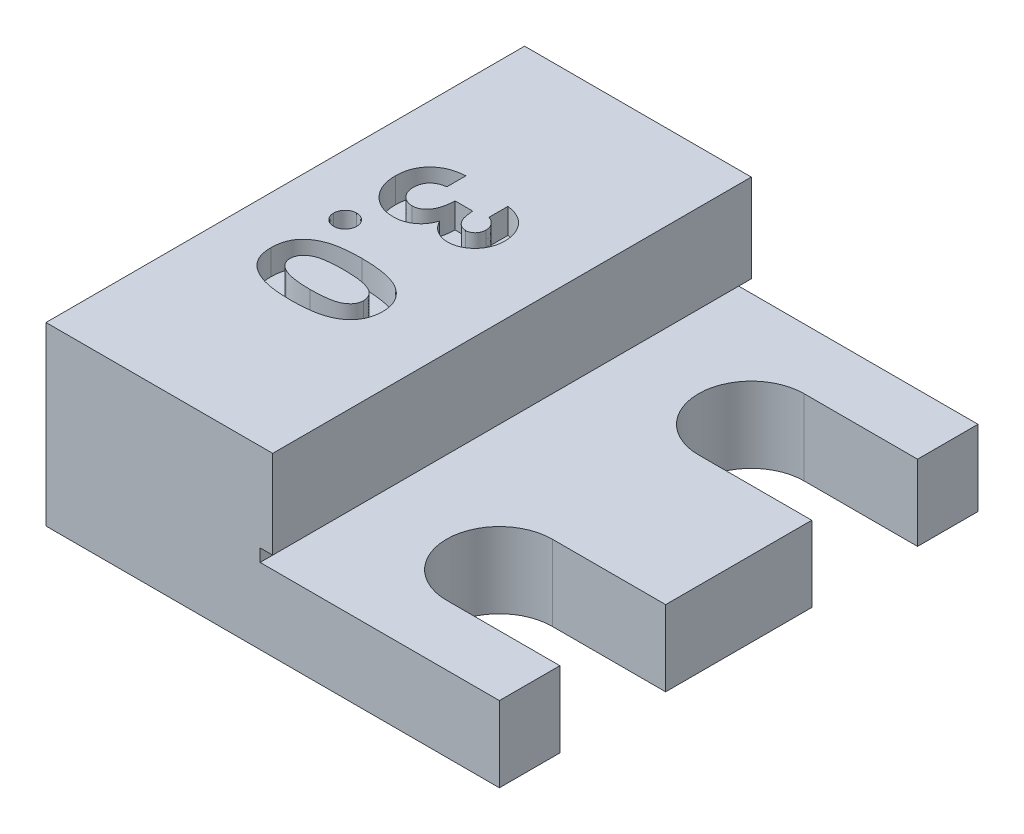
from build123d import *

# Parameters (mm, degrees)
BOSS_EXTRUDE1_DEPTH = 19
CUT_EXTRUDE1_DEPTH  = 28.092434368
CUT_EXTRUDE2_DEPTH  = 1
SKETCH4_W           = 6
SKETCH4_H           = 16
CUT_EXTRUDE3_DEPTH  = 5


with BuildPart() as part:
    # Sketch1 → Boss-Extrude1 (new body)
    with BuildSketch(Plane.XY):
        Polygon((0, 0), (18, 0), (18, 3), (9, 3), (8.5, 3), (8.5, 3.5), (9, 3.5), (9, 7), (0, 7), align=None)
    extrude(amount=BOSS_EXTRUDE1_DEPTH)

    # Sketch2 → Cut-Extrude1 (cut, through all)
    with BuildSketch(Plane(origin=(0, 7, 0), x_dir=(1, 0, 0), z_dir=(0, 1, 0))):
        with BuildLine():
            Line((13.5, -2.4), (18, -2.4))
            Line((18, -2.4), (18, -6.6))
            Line((18, -6.6), (13.5, -6.6))
            ThreePointArc((13.5, -6.6), (11.4, -4.5), (13.5, -2.4))
        make_face()
        with BuildLine():
            Line((13.5, -12.4), (18, -12.4))
            Line((18, -12.4), (18, -16.6))
            Line((18, -16.6), (13.5, -16.6))
            ThreePointArc((13.5, -16.6), (11.4, -14.5), (13.5, -12.4))
        make_face()
    extrude(amount=-CUT_EXTRUDE1_DEPTH, mode=Mode.SUBTRACT)

    # Sketch3 → Cut-Extrude2 (cut)
    # profile 1 of 3: a face of its own
    with BuildSketch(Plane(origin=(0, 7, 0), x_dir=(1, 0, 0), z_dir=(0, 1, 0))):
        with BuildLine():
            Line((5.176923077, -6.592307692), (5.176923077, -5.838461538))
            add(Edge.make_bspline(
                [(5.176923077, -5.838461538), (5.214605157, -5.843783979), (5.288478378, -5.854218271), (5.3954284, -5.879186137), (5.496877816, -5.909050398), (5.592505355, -5.946334403), (5.682481362, -5.990062475), (5.76711459, -6.039789948), (5.846041779, -6.096054396), (5.893587831, -6.139181691), (5.917307692, -6.160697115)],
                knots=[0, 0, 0, 0, 1.111473889, 2.178970933, 3.205615836, 4.199322666, 5.174200091, 6.12565194, 7.064921805, 8, 8, 8, 8], degree=3))
            add(Edge.make_bspline(
                [(5.917307692, -6.160697115), (5.948604331, -6.191730264), (6.010286716, -6.252893337), (6.089295038, -6.355104007), (6.157671368, -6.462239665), (6.211880616, -6.576448964), (6.255756723, -6.69595472), (6.285228403, -6.821707285), (6.304783123, -6.95319279), (6.306709331, -7.042915105), (6.307692308, -7.088701923)],
                knots=[0, 0, 0, 0, 1.01925491, 2.00884431, 2.983262333, 3.955970413, 4.92937149, 5.924503185, 6.940838805, 8, 8, 8, 8], degree=3))
            add(Edge.make_bspline(
                [(6.307692308, -7.088701923), (6.306731299, -7.12940876), (6.30484215, -7.209430199), (6.289677084, -7.32704158), (6.263079247, -7.439174188), (6.228303172, -7.5470133), (6.18098451, -7.648972952), (6.126057614, -7.747303493), (6.058687495, -7.839257565), (5.98256604, -7.925050322), (5.900233234, -8.003867332), (5.812226236, -8.072123208), (5.720895915, -8.13080401), (5.625483489, -8.179149229), (5.525827508, -8.216320132), (5.422503672, -8.242117842), (5.315739973, -8.259003069), (5.243174125, -8.260685279), (5.206370192, -8.261538462)],
                knots=[0, 0, 0, 0, 1.091422571, 2.145516843, 3.172569842, 4.178562979, 5.178154469, 6.181868002, 7.194278174, 8.227918432, 9.254613415, 10.245994977, 11.209837596, 12.161663635, 13.10878368, 14.055455738, 15.013766427, 16, 16, 16, 16], degree=3))
            add(Edge.make_bspline(
                [(5.206370192, -8.261538462), (5.160791586, -8.259787679), (5.071061325, -8.256340927), (4.93973442, -8.228057833), (4.814162463, -8.183787099), (4.696102394, -8.119833718), (4.585875506, -8.039875704), (4.487167015, -7.941769897), (4.398429306, -7.828310608), (4.350741651, -7.743135208), (4.326322115, -7.699519231)],
                knots=[0, 0, 0, 0, 0.992805628, 1.954529043, 2.915727527, 3.886831945, 4.871318353, 5.87440735, 6.911542536, 8, 8, 8, 8], degree=3))
            add(Edge.make_bspline(
                [(4.326322115, -7.699519231), (4.316493057, -7.729456568), (4.297179399, -7.788282094), (4.259141367, -7.871895505), (4.217572103, -7.951402305), (4.169279576, -8.025433414), (4.116216522, -8.094725163), (4.057929339, -8.15885514), (3.99454512, -8.218206507), (3.925715276, -8.271810377), (3.852540607, -8.319385905), (3.776711403, -8.362072894), (3.697077701, -8.397206665), (3.614548972, -8.426969343), (3.528383492, -8.449628952), (3.438915143, -8.465583342), (3.34634801, -8.47480537), (3.283633833, -8.476211887), (3.251923077, -8.476923077)],
                knots=[0, 0, 0, 0, 1.059543567, 2.081955587, 3.086750234, 4.076226789, 5.052108497, 6.020845489, 6.989030705, 7.970690546, 8.952259656, 9.923888338, 10.895517021, 11.877585046, 12.873342345, 13.889638361, 14.932918083, 16, 16, 16, 16], degree=3))
            add(Edge.make_bspline(
                [(3.251923077, -8.476923077), (3.205300655, -8.475604881), (3.11333167, -8.473004562), (2.978311637, -8.453156068), (2.848890045, -8.421274809), (2.724899153, -8.376486925), (2.606728476, -8.31782932), (2.49351837, -8.247043218), (2.386246112, -8.162857835), (2.285094999, -8.067712913), (2.192719092, -7.962389478), (2.112711154, -7.848076645), (2.044029642, -7.727435892), (1.988277264, -7.599664549), (1.945340199, -7.464817524), (1.914303665, -7.323192531), (1.895314912, -7.174195286), (1.893324308, -7.072492978), (1.892307692, -7.020552885)],
                knots=[0, 0, 0, 0, 1.00521177, 1.982915163, 2.936446867, 3.875909237, 4.819955514, 5.776532521, 6.750505675, 7.756026749, 8.767695971, 9.766152086, 10.760201606, 11.756952477, 12.766920653, 13.807416198, 14.880231815, 16, 16, 16, 16], degree=3))
            add(Edge.make_bspline(
                [(1.892307692, -7.020552885), (1.893379267, -6.971418235), (1.895474591, -6.87534193), (1.913619223, -6.734812939), (1.942867752, -6.601243152), (1.984166126, -6.474339599), (2.037374572, -6.354642564), (2.101598051, -6.241454692), (2.178804377, -6.136011646), (2.267171969, -6.03782798), (2.364949621, -5.947736072), (2.472934326, -5.869217452), (2.588766526, -5.800885556), (2.71269532, -5.742289404), (2.845826489, -5.696506963), (2.986971118, -5.660097402), (3.136739527, -5.634749059), (3.239774518, -5.627018439), (3.292307692, -5.623076923)],
                knots=[0, 0, 0, 0, 1.066693477, 2.085777942, 3.071407889, 4.032495163, 4.978645371, 5.911608997, 6.853298848, 7.810770565, 8.776420673, 9.735131334, 10.704462168, 11.693492242, 12.70668109, 13.756973703, 14.856375978, 16, 16, 16, 16], degree=3))
            Line((3.292307692, -5.623076923), (3.292307692, -6.376923077))
            add(Edge.make_bspline(
                [(3.292307692, -6.376923077), (3.26589294, -6.381700121), (3.214443282, -6.391004668), (3.139955616, -6.409152616), (3.071198899, -6.432801924), (3.007562024, -6.460146409), (2.948209461, -6.489682568), (2.895333246, -6.525369312), (2.847497574, -6.564591703), (2.79063, -6.6211899), (2.732200942, -6.70210092), (2.681423311, -6.811357602), (2.651661381, -6.932895315), (2.648030517, -7.017862297), (2.646153846, -7.061778846)],
                knots=[0, 0, 0, 0, 0.928156231, 1.807827665, 2.648129825, 3.438902246, 4.202261636, 4.936546065, 5.639352463, 6.338805438, 7.70633318, 9.064371875, 10.482673459, 12, 12, 12, 12], degree=3))
            add(Edge.make_bspline(
                [(2.646153846, -7.061778846), (2.64655265, -7.085082858), (2.647333816, -7.130730204), (2.656021239, -7.1977736), (2.670268391, -7.261663896), (2.689917095, -7.322663713), (2.713834674, -7.38126943), (2.745462323, -7.43582751), (2.781992266, -7.487457944), (2.822632331, -7.536064519), (2.868299189, -7.579743223), (2.916589802, -7.618275468), (2.967805482, -7.651022011), (3.021833525, -7.676482577), (3.077456781, -7.69845959), (3.136183487, -7.711990402), (3.196880665, -7.722182063), (3.238415437, -7.72277566), (3.259495192, -7.723076923)],
                knots=[0, 0, 0, 0, 1.110156356, 2.174547939, 3.215517325, 4.225827361, 5.226274409, 6.226006852, 7.223592408, 8.238489974, 9.24054302, 10.230036266, 11.179350721, 12.129887733, 13.073255049, 14.023133956, 14.996699621, 16, 16, 16, 16], degree=3))
            add(Edge.make_bspline(
                [(3.259495192, -7.723076923), (3.282549841, -7.722278357), (3.328446364, -7.720688594), (3.395422688, -7.707700068), (3.459848514, -7.687188441), (3.521438533, -7.658695285), (3.579965738, -7.62064585), (3.636604361, -7.575747942), (3.688406463, -7.520464347), (3.739611271, -7.45981084), (3.78424642, -7.3894766), (3.825438105, -7.312887002), (3.858213969, -7.228029154), (3.887488886, -7.136974511), (3.908870831, -7.038000689), (3.924396207, -6.931722279), (3.935952443, -6.818310725), (3.937610376, -6.740134666), (3.938461538, -6.7)],
                knots=[0, 0, 0, 0, 0.809814727, 1.612155564, 2.388397, 3.182215007, 3.988903953, 4.837162975, 5.715530372, 6.646997145, 7.623086902, 8.637258368, 9.698941581, 10.815059213, 11.996518529, 13.252603015, 14.589518788, 16, 16, 16, 16], degree=3))
            Line((3.938461538, -6.7), (4.638461538, -6.7))
            add(Edge.make_bspline(
                [(4.638461538, -6.7), (4.642720946, -6.749969042), (4.650689453, -6.843451225), (4.669261717, -6.973224212), (4.694344108, -7.08268886), (4.724079437, -7.174389005), (4.76247192, -7.250421629), (4.805877462, -7.316069099), (4.854476034, -7.373762098), (4.909375989, -7.422152875), (4.968729917, -7.459673085), (5.030464834, -7.487153076), (5.093737625, -7.505125621), (5.13698456, -7.506841893), (5.158413462, -7.507692308)],
                knots=[0, 0, 0, 0, 1.700000582, 3.18036443, 4.43953496, 5.503843555, 6.439238578, 7.317314143, 8.167035247, 8.988963526, 9.788142765, 10.537231438, 11.275196671, 12, 12, 12, 12], degree=3))
            add(Edge.make_bspline(
                [(5.158413462, -7.507692308), (5.185769251, -7.506252866), (5.239161959, -7.503443381), (5.315248865, -7.481046034), (5.383849081, -7.443815297), (5.443184966, -7.392033152), (5.493351994, -7.329194371), (5.529040895, -7.255047509), (5.550543836, -7.172077536), (5.552720451, -7.113795944), (5.553846154, -7.083653846)],
                knots=[0, 0, 0, 0, 1.009121812, 1.969592135, 2.901310697, 3.870954244, 4.859448864, 5.850870115, 6.888512099, 8, 8, 8, 8], degree=3))
            add(Edge.make_bspline(
                [(5.553846154, -7.083653846), (5.552504695, -7.056337986), (5.549842829, -7.002134953), (5.529886947, -6.922905891), (5.496633292, -6.84775135), (5.44993572, -6.778598731), (5.394429993, -6.715618106), (5.329224068, -6.662810134), (5.256868384, -6.619821176), (5.203675982, -6.601514807), (5.176923077, -6.592307692)],
                knots=[0, 0, 0, 0, 0.988439209, 1.961366134, 2.938893463, 3.950078543, 4.971412263, 5.967491143, 6.977757845, 8, 8, 8, 8], degree=3))
        make_face()
    # profile 2 of 3: a face of its own
    with BuildSketch(Plane(origin=(0, 7, 0), x_dir=(1, 0, 0), z_dir=(0, 1, 0))):
        with BuildLine():
            add(Edge.make_bspline(
                [(2.861538462, -9.526923077), (2.85988287, -9.557362204), (2.856623295, -9.617291589), (2.831853959, -9.703995704), (2.788312606, -9.782702644), (2.730502257, -9.85257974), (2.661701966, -9.911911527), (2.582376507, -9.953401025), (2.496427686, -9.98023852), (2.436302157, -9.983133621), (2.405528846, -9.984615385)],
                knots=[0, 0, 0, 0, 1.016476041, 2.001265769, 2.982571086, 4.001334304, 5.018889842, 5.99575474, 6.974191785, 8, 8, 8, 8], degree=3))
            add(Edge.make_bspline(
                [(2.405528846, -9.984615385), (2.374750787, -9.983143332), (2.31461598, -9.980267206), (2.228495667, -9.95321757), (2.148526587, -9.911977622), (2.078984136, -9.852574786), (2.020088959, -9.78299344), (1.976959039, -9.703815063), (1.950796284, -9.617456418), (1.947716214, -9.557391196), (1.946153846, -9.526923077)],
                knots=[0, 0, 0, 0, 1.022731703, 1.998234309, 2.980426153, 4.002090265, 5.023754376, 6.00211665, 6.986572482, 8, 8, 8, 8], degree=3))
            add(Edge.make_bspline(
                [(1.946153846, -9.526923077), (1.947729022, -9.496462175), (1.950834344, -9.436411182), (1.976740674, -9.350186567), (2.020380314, -9.271588463), (2.078913136, -9.202024595), (2.14877397, -9.142885964), (2.228244922, -9.100439216), (2.314648555, -9.073639214), (2.374761815, -9.070723224), (2.405528846, -9.069230769)],
                knots=[0, 0, 0, 0, 1.013910294, 1.9988351, 2.969460266, 3.991611077, 5.013761889, 6.000813773, 6.976781088, 8, 8, 8, 8], degree=3))
            add(Edge.make_bspline(
                [(2.405528846, -9.069230769), (2.436290937, -9.070733066), (2.496394544, -9.073668284), (2.582630141, -9.100255237), (2.661453239, -9.142949764), (2.730573405, -9.202019856), (2.788023525, -9.271877769), (2.832069332, -9.350006935), (2.856584954, -9.436576095), (2.859869955, -9.496491201), (2.861538462, -9.526923077)],
                knots=[0, 0, 0, 0, 1.02629359, 2.005193596, 2.986963232, 4.00500024, 5.0242455, 5.997787305, 6.983042999, 8, 8, 8, 8], degree=3))
        make_face()
    # profile 3 of 3: a face of its own
    with BuildSketch(Plane(origin=(0, 7, 0), x_dir=(1, 0, 0), z_dir=(0, 1, 0))):
        with BuildLine():
            add(Edge.make_bspline(
                [(6.307692308, -11.937379808), (6.307150683, -11.973869128), (6.306085705, -12.045616881), (6.29454866, -12.151287171), (6.277124504, -12.25307935), (6.252805809, -12.351380113), (6.220685788, -12.445523764), (6.18190987, -12.536269402), (6.135550949, -12.622853881), (6.082281439, -12.705477488), (6.02270567, -12.784525027), (5.953841518, -12.857366744), (5.878739381, -12.926822083), (5.796159568, -12.991739367), (5.705539209, -13.051391781), (5.608078808, -13.106892863), (5.502860985, -13.157526901), (5.389778503, -13.20396373), (5.267117399, -13.245505969), (5.133456997, -13.280398151), (4.988893108, -13.310732399), (4.832672601, -13.334621473), (4.665163984, -13.354174114), (4.486053808, -13.366949594), (4.295843307, -13.375837098), (4.16535578, -13.376554506), (4.098317308, -13.376923077)],
                knots=[0, 0, 0, 0, 0.879087513, 1.728520926, 2.558587148, 3.366762743, 4.166157112, 4.95337177, 5.74258602, 6.530032775, 7.320866164, 8.124307838, 8.942260106, 9.784645725, 10.652593514, 11.554662219, 12.485739241, 13.464770064, 14.499274465, 15.604285219, 16.792026686, 18.057713884, 19.411711354, 20.855437135, 22.384468668, 24, 24, 24, 24], degree=3))
            add(Edge.make_bspline(
                [(4.098317308, -13.376923077), (4.030440525, -13.37652196), (3.898557155, -13.375742597), (3.70660119, -13.367345458), (3.526210383, -13.3528853), (3.357403645, -13.334247649), (3.200269274, -13.308720394), (3.054403265, -13.278820445), (2.919848806, -13.243303124), (2.79694166, -13.200378221), (2.68359105, -13.154337682), (2.578944999, -13.103208582), (2.481123496, -13.050067474), (2.391489769, -12.991693005), (2.309846766, -12.929325786), (2.235444428, -12.863944923), (2.169307235, -12.794157234), (2.110069404, -12.7210064), (2.058216793, -12.642714885), (2.01366831, -12.55962707), (1.976853175, -12.471182306), (1.9451208, -12.378667246), (1.922290893, -12.280436063), (1.90419103, -12.178005479), (1.894184694, -12.070231506), (1.892943628, -11.99685416), (1.892307692, -11.959254808)],
                knots=[0, 0, 0, 0, 1.643682949, 3.193646483, 4.651618242, 6.025629174, 7.305184366, 8.505292942, 9.630500342, 10.672179876, 11.655924581, 12.591484594, 13.491256898, 14.350247848, 15.17884557, 15.977481787, 16.746098769, 17.504475725, 18.254166354, 19.016819136, 19.783753977, 20.571954997, 21.382401421, 22.223156612, 23.089526058, 24, 24, 24, 24], degree=3))
            add(Edge.make_bspline(
                [(1.892307692, -11.959254808), (1.892958632, -11.921657209), (1.894233814, -11.848004067), (1.904086281, -11.739928272), (1.922520224, -11.636723558), (1.944975925, -11.537578193), (1.977024282, -11.443362893), (2.014430371, -11.353389364), (2.059233294, -11.268105532), (2.110855853, -11.187457673), (2.170065111, -11.11173783), (2.236213665, -11.03976485), (2.309137681, -10.971699163), (2.389652904, -10.908575843), (2.476684941, -10.84936136), (2.571227482, -10.794672603), (2.673143257, -10.744544816), (2.782572889, -10.697400516), (2.901878097, -10.656467963), (3.032100284, -10.619915704), (3.174468576, -10.590475047), (3.328448015, -10.564687625), (3.494578206, -10.547373), (3.672092814, -10.532564683), (3.861539617, -10.524279313), (3.991739434, -10.523485583), (4.058774038, -10.523076923)],
                knots=[0, 0, 0, 0, 0.917197984, 1.796777363, 2.643741708, 3.473481078, 4.273990801, 5.068160217, 5.848535553, 6.620952589, 7.401027954, 8.190319769, 9.003592045, 9.831693788, 10.683727512, 11.569696396, 12.49373307, 13.453184301, 14.474457586, 15.568383184, 16.750575061, 18.019320986, 19.375517054, 20.823796471, 22.364701649, 24, 24, 24, 24], degree=3))
            add(Edge.make_bspline(
                [(4.058774038, -10.523076923), (4.151913091, -10.523808273), (4.331626093, -10.525219423), (4.591295751, -10.542644047), (4.83113749, -10.569002763), (5.051441104, -10.605085819), (5.251775391, -10.653685764), (5.432082806, -10.713328421), (5.594148159, -10.781764373), (5.690172203, -10.839987872), (5.736418269, -10.868028846)],
                knots=[0, 0, 0, 0, 1.288526675, 2.486228817, 3.599112392, 4.626206381, 5.5730174, 6.447949553, 7.252518174, 8, 8, 8, 8], degree=3))
            add(Edge.make_bspline(
                [(5.736418269, -10.868028846), (5.781849131, -10.900640072), (5.870675418, -10.964401446), (5.987287729, -11.07588999), (6.087020287, -11.195669914), (6.167616056, -11.326201431), (6.231173886, -11.46542013), (6.276064066, -11.614521274), (6.302219176, -11.772954258), (6.305840687, -11.881752831), (6.307692308, -11.937379808)],
                knots=[0, 0, 0, 0, 1.058512271, 2.069600068, 3.047294572, 4.004278952, 4.967380941, 5.939006123, 6.946246673, 8, 8, 8, 8], degree=3))
        make_face()
        with BuildLine():
            add(Edge.make_bspline(
                [(5.553846154, -11.955889423), (5.552270668, -11.922908887), (5.54918188, -11.858249528), (5.523401693, -11.764568479), (5.48271655, -11.676626924), (5.434760512, -11.609308285), (5.387973655, -11.559148094), (5.34693293, -11.522793846), (5.298932536, -11.490234906), (5.246047261, -11.458820008), (5.186821663, -11.430869169), (5.12274956, -11.403076295), (5.051691887, -11.380433104), (4.974987834, -11.358133021), (4.89047493, -11.338636996), (4.797488532, -11.322180048), (4.695329433, -11.307988824), (4.584245274, -11.296006011), (4.463793783, -11.288387596), (4.3342554, -11.281014932), (4.195362046, -11.278331006), (4.099719168, -11.277402337), (4.050360577, -11.276923077)],
                knots=[0, 0, 0, 0, 1.076821401, 2.111141558, 3.153197101, 4.23200803, 4.796476379, 5.394298193, 6.020090776, 6.690078086, 7.403703365, 8.159894791, 8.971856079, 9.83973388, 10.771758647, 11.806038152, 12.926526118, 14.143777411, 15.458313878, 16.872423957, 18.385946227, 20, 20, 20, 20], degree=3))
            add(Edge.make_bspline(
                [(4.050360577, -11.276923077), (3.986412475, -11.277690687), (3.863787247, -11.279162637), (3.687454343, -11.286901656), (3.526954651, -11.302324436), (3.381298609, -11.321757427), (3.251038899, -11.348230248), (3.136135085, -11.381192718), (3.035736471, -11.41774611), (2.951319527, -11.463577141), (2.879125714, -11.512681076), (2.816674456, -11.565091786), (2.764651799, -11.621723368), (2.720485601, -11.680883073), (2.687689615, -11.744764797), (2.663780285, -11.812058623), (2.649202201, -11.882913935), (2.647175838, -11.931423642), (2.646153846, -11.955889423)],
                knots=[0, 0, 0, 0, 1.772047989, 3.398033405, 4.888860297, 6.238411839, 7.468309579, 8.567754056, 9.549141588, 10.421774021, 11.221426488, 11.965694757, 12.675067502, 13.348095901, 14.005005053, 14.656328889, 15.322321954, 16, 16, 16, 16], degree=3))
            add(Edge.make_bspline(
                [(2.646153846, -11.955889423), (2.64685234, -11.979516527), (2.648219904, -12.025775459), (2.662257763, -12.093231342), (2.685080272, -12.157022417), (2.717364314, -12.216956081), (2.758418413, -12.273246707), (2.808422978, -12.325619182), (2.867876439, -12.373678523), (2.911999699, -12.401678113), (2.934735577, -12.416105769)],
                knots=[0, 0, 0, 0, 0.992283464, 1.942767638, 2.88273346, 3.832339453, 4.79467288, 5.803907806, 6.868395428, 8, 8, 8, 8], degree=3))
            add(Edge.make_bspline(
                [(2.934735577, -12.416105769), (2.965802388, -12.43309715), (3.030946973, -12.468726699), (3.140897888, -12.509852713), (3.264748166, -12.544936354), (3.403499208, -12.573060354), (3.556594281, -12.59533645), (3.724147171, -12.61236653), (3.906398045, -12.62101668), (4.032684545, -12.622372359), (4.098317308, -12.623076923)],
                knots=[0, 0, 0, 0, 0.710996797, 1.490902623, 2.352723643, 3.296875318, 4.334065587, 5.461510359, 6.680713396, 8, 8, 8, 8], degree=3))
            add(Edge.make_bspline(
                [(4.098317308, -12.623076923), (4.164517758, -12.622799909), (4.291942324, -12.622266703), (4.474875271, -12.612483906), (4.641954183, -12.598860635), (4.79280593, -12.578933654), (4.927797071, -12.55329418), (5.046917647, -12.521692777), (5.150406, -12.484439109), (5.238147698, -12.440254292), (5.312742503, -12.391337042), (5.37665067, -12.339343271), (5.431670617, -12.284183068), (5.476266621, -12.225262109), (5.511810773, -12.162973601), (5.536033359, -12.096981471), (5.55093428, -12.027505248), (5.552862428, -11.980083575), (5.553846154, -11.955889423)],
                knots=[0, 0, 0, 0, 1.793903324, 3.452957663, 4.963427329, 6.336122014, 7.574844885, 8.684777121, 9.673127442, 10.55010789, 11.340650774, 12.086136756, 12.779466299, 13.446812155, 14.083183996, 14.715685896, 15.34475337, 16, 16, 16, 16], degree=3))
        make_face(mode=Mode.SUBTRACT)
    extrude(amount=-CUT_EXTRUDE2_DEPTH, mode=Mode.SUBTRACT)

    # Sketch4 → Cut-Extrude3 (cut)
    with BuildSketch(Plane.XZ):
        with Locations((4.5, 9.5)):
            Rectangle(SKETCH4_W, SKETCH4_H)
    extrude(amount=-CUT_EXTRUDE3_DEPTH, mode=Mode.SUBTRACT)


solid = part.part
